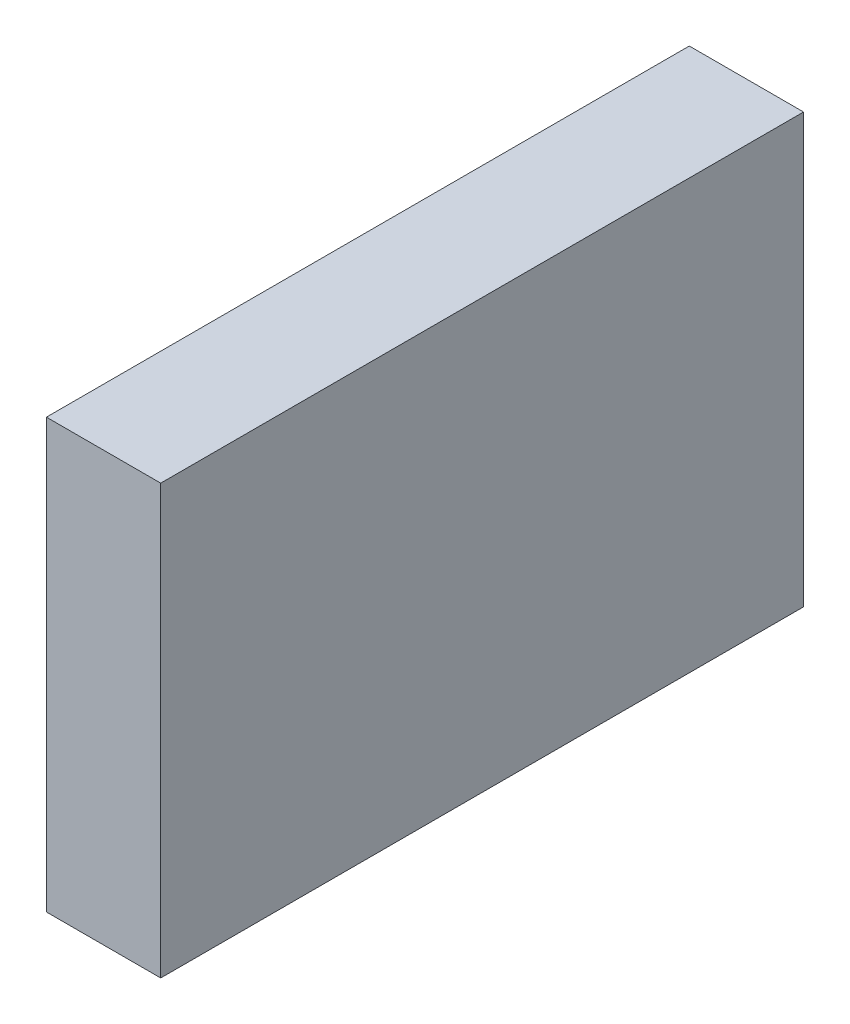
from build123d import *

# Parameters (mm, degrees)
SKETCH_1_W      = 8
SKETCH_1_H      = 30
EXTRUDE_1_DEPTH = 45


with BuildPart() as part:
    # 草圖1 → 填料-伸長1 (new body)
    with BuildSketch(Plane.XY):
        Rectangle(SKETCH_1_W, SKETCH_1_H)
    extrude(amount=EXTRUDE_1_DEPTH)


solid = part.part
